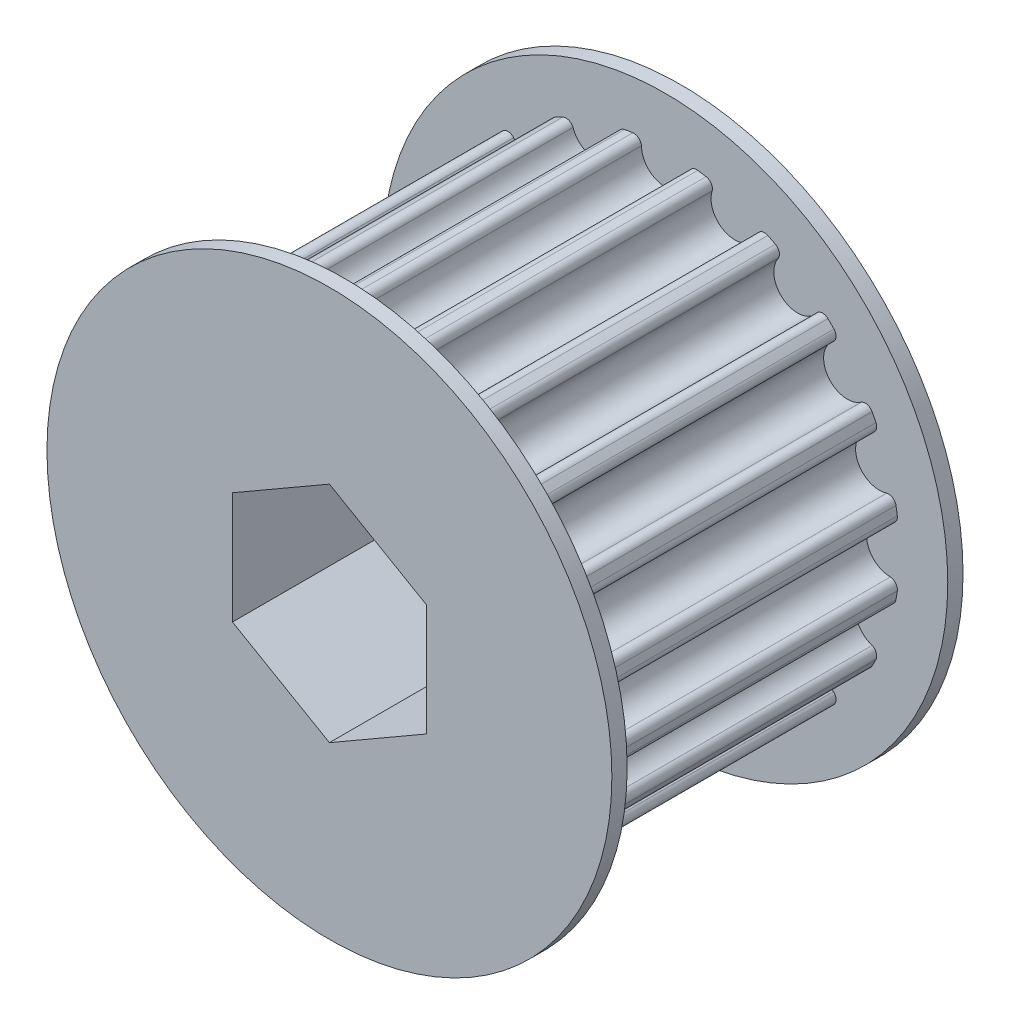
from build123d import *

# Parameters (mm, degrees)
SKETCH2_R                = 15.343994309
BOSS_EXTRUDE1_DEPTH      = 21
CUT_EXTRUDE1_DEPTH       = 31.19728999
FILLET1_R                = 0.5
CIRPATTERN1_COUNT        = 20
FILLET1_OF_CIRPATTERN1_R = 0.5
CUT_EXTRUDE2_DEPTH       = 31.051908029
SKETCH7_R                = 18.5
BOSS_EXTRUDE2_DEPTH      = 1


with BuildPart() as part:
    # Sketch2 → Boss-Extrude1 (new body)
    with BuildSketch(Plane.XY):
        with Locations(Location((0, 0, 0), (0, 0, 180))):
            Circle(SKETCH2_R)
    extrude(amount=BOSS_EXTRUDE1_DEPTH)

    # Sketch3 → Cut-Extrude1 (cut, through all)
    with BuildSketch(Plane(origin=(0, 0, 0), x_dir=(-1, 0, 0), z_dir=(0, 0, -1))):
        with BuildLine():
            Line((-1.614471729, 15.258821789), (-1.56, 14.743994309))
            ThreePointArc((-1.56, 14.743994309), (0, 13.183994309), (1.56, 14.743994309))
            Line((1.56, 14.743994309), (1.614471729, 15.258821789))
            ThreePointArc((1.614471729, 15.258821789), (0, 15.343994309), (-1.614471729, 15.258821789))
        make_face()
    cut_extrude1 = extrude(amount=-CUT_EXTRUDE1_DEPTH, mode=Mode.SUBTRACT)

    # Fillet1
    fillet1_edges = [part.edges().sort_by_distance(p)[0] for p in [
        (1.614471729, 15.258821789, 10.5),
        (-1.614471729, 15.258821789, 10.5),
    ]]
    fillet(fillet1_edges, radius=FILLET1_R)

    # CirPattern1: Cut-Extrude1 ×20 about axis
    cirpattern1_axis = Axis((0, 0, 0), (0, 0, 1))
    for i in range(1, CIRPATTERN1_COUNT):
        add(cut_extrude1.rotate(cirpattern1_axis, i * 360 / CIRPATTERN1_COUNT), mode=Mode.SUBTRACT)

    # Fillet1 of CirPattern1
    fillet1_of_cirpattern1_edges = [part.edges().sort_by_distance(p)[0] for p in [
        (-3.179781388, 15.010901095, 10.5),
        (-6.250689106, 14.013102692, 10.5),
        (-7.662775349, 13.293608814, 10.5),
        (-10.275045481, 11.395683469, 10.5),
        (-11.395683469, 10.275045481, 10.5),
        (-13.293608814, 7.662775349, 10.5),
        (-14.013102692, 6.250689106, 10.5),
        (-15.010901095, 3.179781388, 10.5),
        (-15.258821789, 1.614471729, 10.5),
        (-15.258821789, -1.614471729, 10.5),
        (-15.010901095, -3.179781388, 10.5),
        (-14.013102692, -6.250689106, 10.5),
        (-13.293608814, -7.662775349, 10.5),
        (-11.395683469, -10.275045481, 10.5),
        (-10.275045481, -11.395683469, 10.5),
        (-7.662775349, -13.293608814, 10.5),
        (-6.250689106, -14.013102692, 10.5),
        (-3.179781388, -15.010901095, 10.5),
        (-1.614471729, -15.258821789, 10.5),
        (1.614471729, -15.258821789, 10.5),
        (3.179781388, -15.010901095, 10.5),
        (6.250689106, -14.013102692, 10.5),
        (7.662775349, -13.293608814, 10.5),
        (10.275045481, -11.395683469, 10.5),
        (11.395683469, -10.275045481, 10.5),
        (13.293608814, -7.662775349, 10.5),
        (14.013102692, -6.250689106, 10.5),
        (15.010901095, -3.179781388, 10.5),
        (15.258821789, -1.614471729, 10.5),
        (15.258821789, 1.614471729, 10.5),
        (15.010901095, 3.179781388, 10.5),
        (14.013102692, 6.250689106, 10.5),
        (13.293608814, 7.662775349, 10.5),
        (11.395683469, 10.275045481, 10.5),
        (10.275045481, 11.395683469, 10.5),
        (7.662775349, 13.293608814, 10.5),
        (6.250689106, 14.013102692, 10.5),
        (3.179781388, 15.010901095, 10.5),
    ]]
    fillet(fillet1_of_cirpattern1_edges, radius=FILLET1_OF_CIRPATTERN1_R)

    # Sketch5 → Cut-Extrude2 (cut, through all)
    with BuildSketch(Plane(origin=(0, 0, 0), x_dir=(-1, 0, 0), z_dir=(0, 0, -1))):
        Polygon((0, -7.332348419), (6.35, -3.666174209), (6.35, 3.666174209), (0, 7.332348419), (-6.35, 3.666174209), (-6.35, -3.666174209), align=None)
    extrude(amount=-CUT_EXTRUDE2_DEPTH, mode=Mode.SUBTRACT)

    # Sketch7 → Boss-Extrude2 (add)
    with BuildSketch(Plane.XY.offset(21)):
        Circle(SKETCH7_R)
        Polygon((6.35, -3.666174209), (0, -7.332348419), (-6.35, -3.666174209), (-6.35, 3.666174209), (0, 7.332348419), (6.35, 3.666174209), align=None, mode=Mode.SUBTRACT)
    boss_extrude2 = extrude(amount=BOSS_EXTRUDE2_DEPTH)

    # Mirror1: Boss-Extrude2 across plane
    add(boss_extrude2.mirror(Plane.XY.offset(10.5)))


solid = part.part
